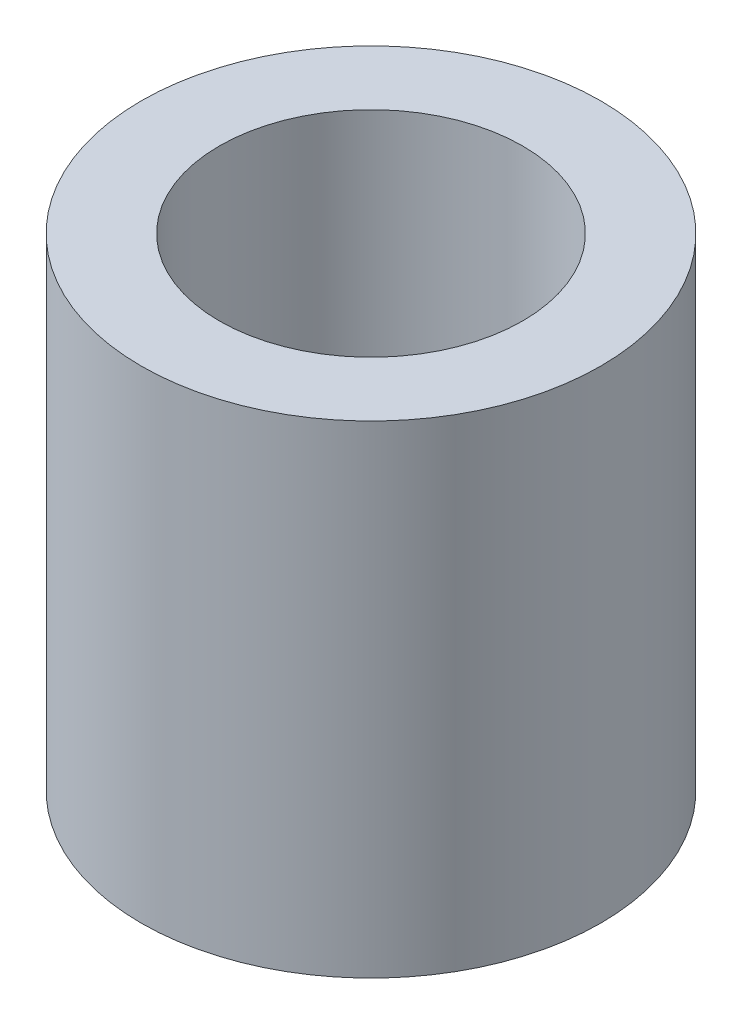
from build123d import *

# Parameters (mm, degrees)
SKETCH1_R           = 2.5
SKETCH1_R_2         = 1.65
BOSS_EXTRUDE1_DEPTH = 5.25


with BuildPart() as part:
    # Sketch1 → Boss-Extrude1 (new body)
    with BuildSketch(Plane(origin=(0, 0, 0), x_dir=(1, 0, 0), z_dir=(0, 1, 0))):
        with Locations(Location((0, 0, 0), (0, 0, 90))):
            Circle(SKETCH1_R)
        with Locations(Location((0, 0, 0), (0, 0, 90))):
            Circle(SKETCH1_R_2, mode=Mode.SUBTRACT)
    extrude(amount=BOSS_EXTRUDE1_DEPTH)


solid = part.part
